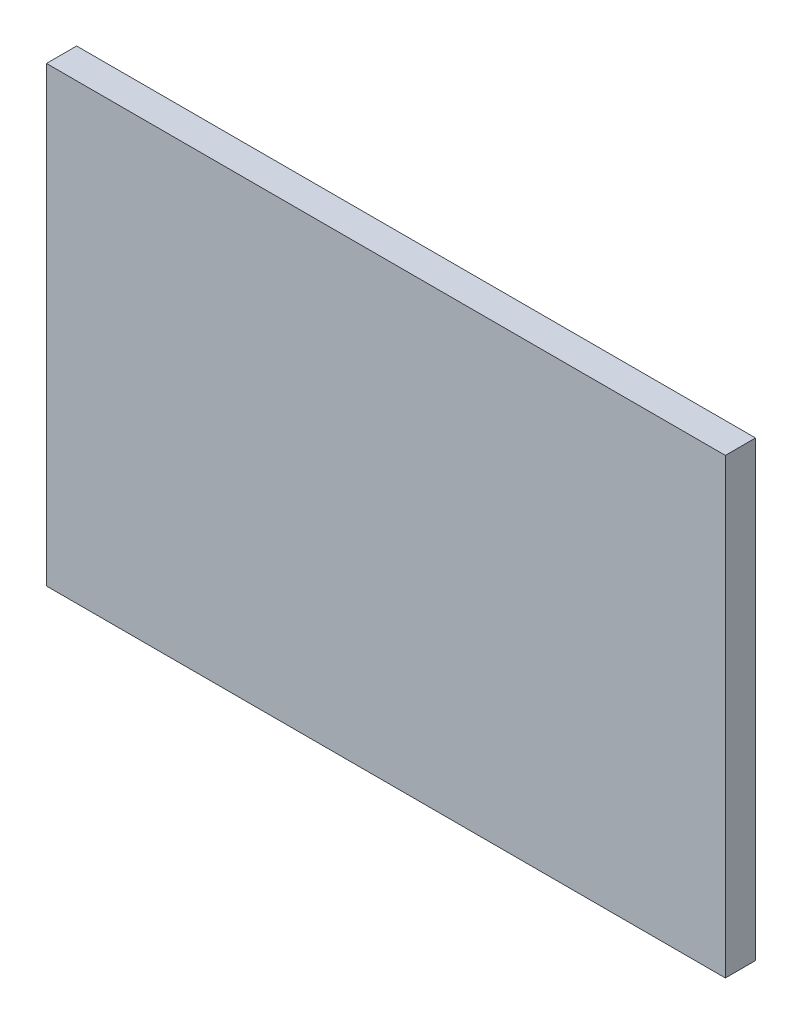
from build123d import *

# Parameters (mm, degrees)
SKETCH1_W           = 45
SKETCH1_H           = 30
BOSS_EXTRUDE1_DEPTH = 2


with BuildPart() as part:
    # Sketch1 → Boss-Extrude1 (new body)
    with BuildSketch(Plane.XY):
        Rectangle(SKETCH1_W, SKETCH1_H)
    extrude(amount=BOSS_EXTRUDE1_DEPTH)


solid = part.part
